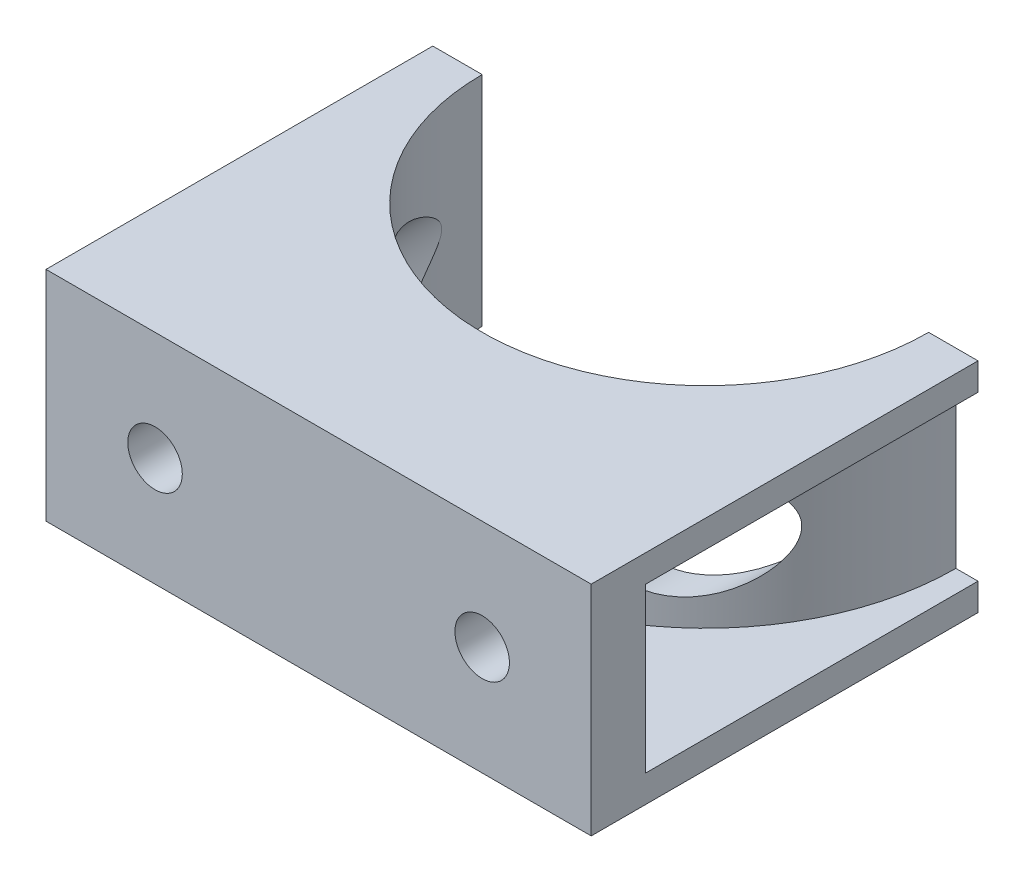
from build123d import *

# Parameters (mm, degrees)
BOSS_EXTRUDE1_DEPTH = 25.4
CUT_EXTRUDE3_START  = -3.175
CUT_EXTRUDE3_DEPTH  = 19.05
SKETCH5_R           = 3.175
CUT_EXTRUDE4_DEPTH  = 6.35
CUT_EXTRUDE5_REACH  = 62.685
SKETCH6_R           = 6.4135


with BuildPart() as part:
    # Sketch1 → Boss-Extrude1 (new body)
    with BuildSketch(Plane(origin=(0, 0, 0), x_dir=(1, 0, 0), z_dir=(0, 1, 0))):
        with BuildLine():
            Line((26, 22.525), (31.75, 22.525))
            Line((31.75, 22.525), (31.75, -22.525))
            Line((31.75, -22.525), (-31.75, -22.525))
            Line((-31.75, -22.525), (-31.75, 22.525))
            Line((-31.75, 22.525), (-26, 22.525))
            ThreePointArc((-26, 22.525), (0, -3.475), (26, 22.525))
        make_face()
    extrude(amount=BOSS_EXTRUDE1_DEPTH)

    # Sketch3 → Cut-Extrude3 (cut)
    with BuildSketch(Plane(origin=(0, 25.4, 0), x_dir=(1, 0, 0), z_dir=(0, 1, 0)).offset(CUT_EXTRUDE3_START)):
        with BuildLine():
            Line((-31.75, -16.175), (31.75, -16.175))
            Line((31.75, -16.175), (31.75, 22.525))
            Line((31.75, 22.525), (29.175, 22.525))
            ThreePointArc((29.175, 22.525), (0, -6.65), (-29.175, 22.525))
            Line((-29.175, 22.525), (-31.75, 22.525))
            Line((-31.75, 22.525), (-31.75, -16.175))
        make_face()
    extrude(amount=-CUT_EXTRUDE3_DEPTH, mode=Mode.SUBTRACT)

    # Sketch5 → Cut-Extrude4 (cut)
    with BuildSketch(Plane.XY.offset(22.525)):
        with Locations((-19.05, 12.7)):
            Circle(SKETCH5_R)
        with Locations((19.05, 12.7)):
            Circle(SKETCH5_R)
    extrude(amount=-CUT_EXTRUDE4_DEPTH, mode=Mode.SUBTRACT)

    # Cut-Extrude5: up to this face of the body (flat: up to its plane)
    cut_extrude5_end = Plane(part.part.faces().sort_by_distance((0, 12.7, 16.175))[0])
    # Sketch6 → Cut-Extrude5 (cut, up to the picked face)
    with BuildSketch(Plane(origin=(0, 0, -22.525), x_dir=(-1, 0, 0), z_dir=(0, 0, -1)), mode=Mode.PRIVATE) as cut_extrude5_sk1:
        with Locations((-19.05, 12.7)):
            Circle(SKETCH6_R)
    cut_extrude5_tool1 = split(extrude(cut_extrude5_sk1.sketch, amount=-CUT_EXTRUDE5_REACH, mode=Mode.PRIVATE), bisect_by=cut_extrude5_end, keep=Keep.BOTH, mode=Mode.PRIVATE)
    # Sketch6 → Cut-Extrude5 (cut, up to the picked face)
    with BuildSketch(Plane(origin=(0, 0, -22.525), x_dir=(-1, 0, 0), z_dir=(0, 0, -1)), mode=Mode.PRIVATE) as cut_extrude5_sk2:
        with Locations((19.05, 12.7)):
            Circle(SKETCH6_R)
    cut_extrude5_tool2 = split(extrude(cut_extrude5_sk2.sketch, amount=-CUT_EXTRUDE5_REACH, mode=Mode.PRIVATE), bisect_by=cut_extrude5_end, keep=Keep.BOTH, mode=Mode.PRIVATE)
    add(cut_extrude5_tool1.solids().sort_by(Axis((19.05, 12.7, -22.525), (0, 0, 1)))[0], mode=Mode.SUBTRACT)
    add(cut_extrude5_tool2.solids().sort_by(Axis((-19.05, 12.7, -22.525), (0, 0, 1)))[0], mode=Mode.SUBTRACT)


solid = part.part
